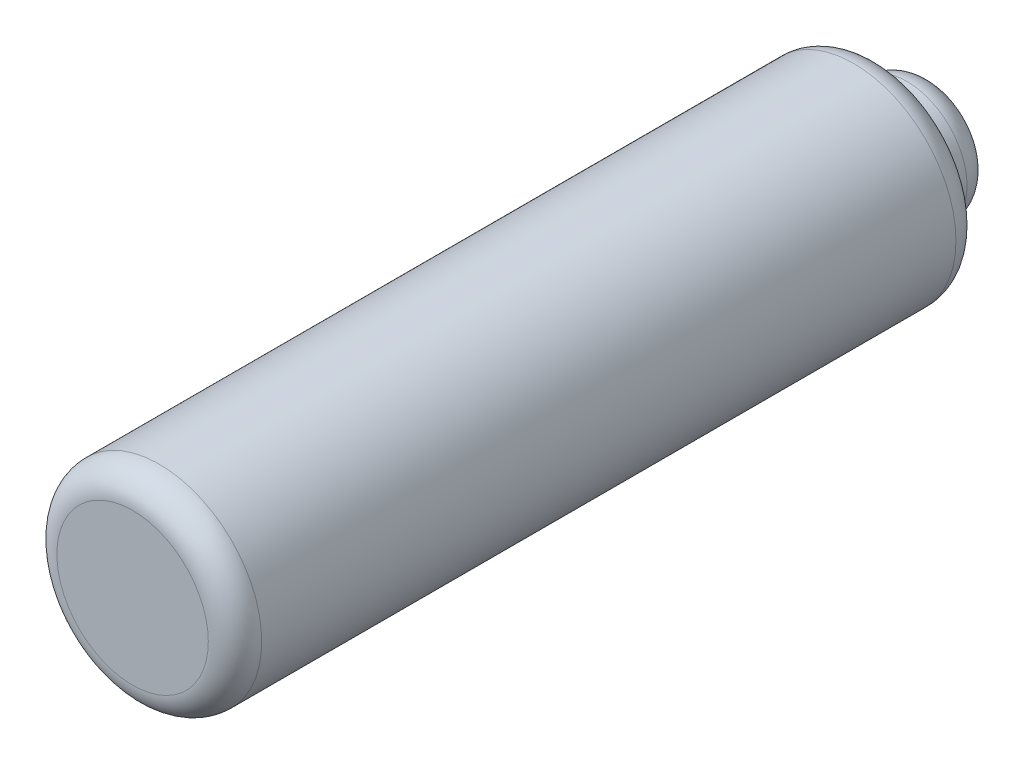
from build123d import *

# Parameters (mm, degrees)
SKETCH1_R           = 3.835
BOSS_EXTRUDE1_DEPTH = 14
SKETCH2_R           = 2.25
BOSS_EXTRUDE2_DEPTH = 2
FILLET1_R           = 1


with BuildPart() as part:
    # Sketch1 → Boss-Extrude1 (new, symmetric)
    with BuildSketch(Plane.XY):
        Circle(SKETCH1_R)
    extrude(amount=BOSS_EXTRUDE1_DEPTH, both=True)

    # Sketch2 → Boss-Extrude2 (add)
    with BuildSketch(Plane(origin=(0, 0, -14), x_dir=(-1, 0, 0), z_dir=(0, 0, -1))):
        Circle(SKETCH2_R)
    extrude(amount=BOSS_EXTRUDE2_DEPTH)

    # Fillet1
    fillet1_edges = [part.edges().sort_by_distance(p)[0] for p in [
        (-3.835, 0, -14),
        (-3.835, 0, 14),
        (2.25, 0, -16),
    ]]
    fillet(fillet1_edges, radius=FILLET1_R)


solid = part.part
